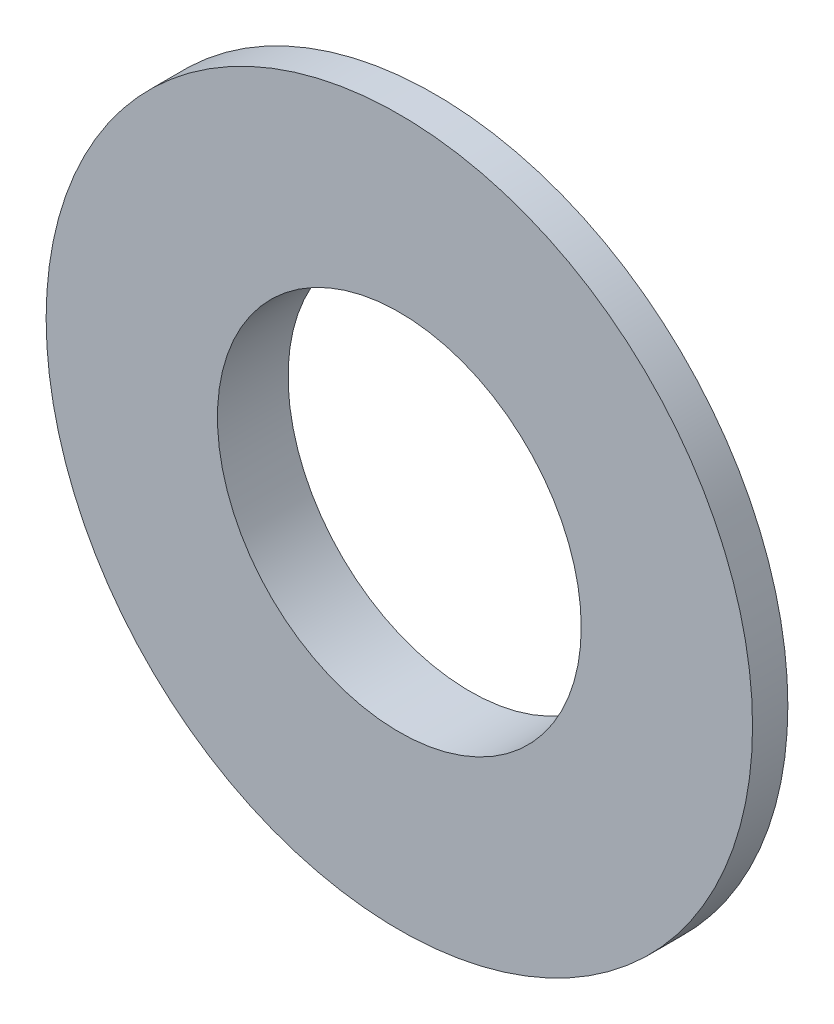
from build123d import *

# Parameters (mm, degrees)
ESQUISSE1_R        = 15.7
ESQUISSE1_R_2      = 10.3
BOSS_EXTRU_1_DEPTH = 2
ESQUISSE2_R        = 20
ESQUISSE2_R_2      = 15.7
ESQUISSE2_R_3      = 10.3
BOSS_EXTRU_3_DEPTH = 2
ECHELLE1_SCALE     = 2
ECHELLE2_SCALE     = 0.25


with BuildPart() as part:
    # Esquisse1 → Boss.-Extru.1 (new body)
    with BuildSketch(Plane.XY):
        Circle(ESQUISSE1_R)
        Circle(ESQUISSE1_R_2, mode=Mode.SUBTRACT)
    extrude(amount=BOSS_EXTRU_1_DEPTH)

    # Esquisse2 → Boss.-Extru.3 (add)
    # profile 1 of 2: a face of its own
    with BuildSketch(Plane.XY.offset(2)):
        Circle(ESQUISSE2_R)
        Circle(ESQUISSE2_R_2, mode=Mode.SUBTRACT)
    # profile 2 of 2: a face of its own
    with BuildSketch(Plane.XY.offset(2)):
        Circle(ESQUISSE2_R_2)
        Circle(ESQUISSE2_R_3, mode=Mode.SUBTRACT)
    extrude(amount=BOSS_EXTRU_3_DEPTH)


with BuildPart() as part_1:
    # Echelle1: scaled about (0, 0, 2.353457208)
    add(part.part.scale(ECHELLE1_SCALE).moved(Location((0, 0, -2.353457208))))


with BuildPart() as part_2:
    # Echelle2: scaled about (0, 0, 2.353457208)
    add(part_1.part.scale(ECHELLE2_SCALE).moved(Location((0, 0, 1.765092906))))


solid = part_2.part
